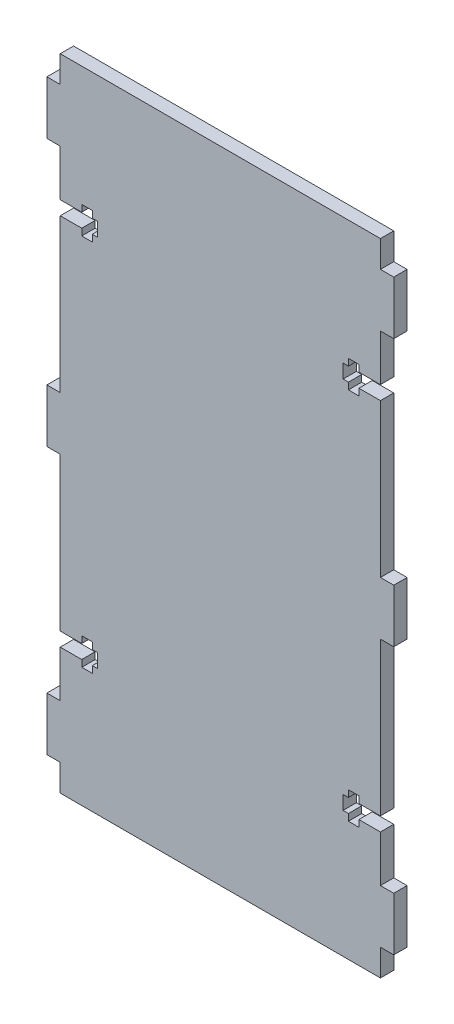
from build123d import *

# Parameters (mm, degrees)
SKETCH1_W           = 76.2
SKETCH1_H           = 152.4
BOSS_EXTRUDE1_DEPTH = 3.175
SKETCH2_W           = 3.175
SKETCH2_H           = 12.7
BOSS_EXTRUDE3_DEPTH = 3.175
SKETCH4_W           = 8.89
SKETCH4_H           = 3.302
SKETCH4_W_2         = 2.5
SKETCH4_H_2         = 6.5
CUT_EXTRUDE4_DEPTH  = 3.175


with BuildPart() as part:
    # Sketch1 → Boss-Extrude1 (new body)
    with BuildSketch(Plane.XY):
        with Locations((38.1, 76.2)):
            Rectangle(SKETCH1_W, SKETCH1_H)
    extrude(amount=BOSS_EXTRUDE1_DEPTH)

    # Sketch2 → Boss-Extrude3 (add)
    with BuildSketch(Plane.XY.offset(3.175)):
        with Locations((-1.5875, 76.2)):
            Rectangle(SKETCH2_W, SKETCH2_H)
        with Locations((77.7875, 139.7)):
            Rectangle(SKETCH2_W, SKETCH2_H)
        with Locations((77.7875, 76.2)):
            Rectangle(SKETCH2_W, SKETCH2_H)
        with Locations((77.7875, 12.7)):
            Rectangle(SKETCH2_W, SKETCH2_H)
        with Locations((-1.5875, 12.7)):
            Rectangle(SKETCH2_W, SKETCH2_H)
        with Locations((-1.5875, 139.7)):
            Rectangle(SKETCH2_W, SKETCH2_H)
    extrude(amount=-BOSS_EXTRUDE3_DEPTH)

    # Sketch4 → Cut-Extrude4 (cut)
    with BuildSketch(Plane.XY.offset(3.175)):
        with Locations((4.445, 120.65)):
            Rectangle(SKETCH4_W, SKETCH4_H)
        with Locations((6.37, 120.65)):
            Rectangle(SKETCH4_W_2, SKETCH4_H_2)
        with Locations((6.37, 31.75)):
            Rectangle(SKETCH4_W_2, SKETCH4_H_2)
        with Locations((4.445, 31.75)):
            Rectangle(SKETCH4_W, SKETCH4_H)
        with Locations((71.755, 31.75)):
            Rectangle(SKETCH4_W, SKETCH4_H)
        with Locations((69.83, 31.75)):
            Rectangle(SKETCH4_W_2, SKETCH4_H_2)
        with Locations((69.83, 120.65)):
            Rectangle(SKETCH4_W_2, SKETCH4_H_2)
        with Locations((71.755, 120.65)):
            Rectangle(SKETCH4_W, SKETCH4_H)
    extrude(amount=-CUT_EXTRUDE4_DEPTH, mode=Mode.SUBTRACT)


solid = part.part
